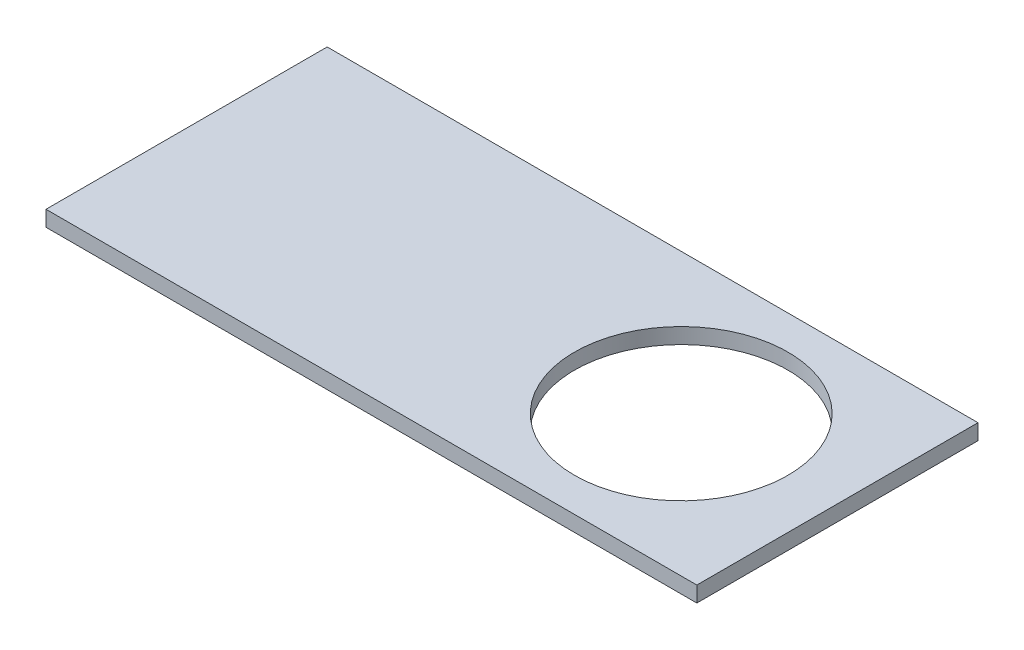
from build123d import *

# Parameters (mm, degrees)
SKETCH_1_W      = 250
SKETCH_1_H      = 108
SKETCH_1_R      = 41
EXTRUDE_1_DEPTH = 6


with BuildPart() as part:
    # Эскиз1 → Бобышка-Вытянуть1 (new body)
    with BuildSketch(Plane(origin=(0, 0, 0), x_dir=(1, 0, 0), z_dir=(0, 1, 0))):
        Rectangle(SKETCH_1_W, SKETCH_1_H)
        with Locations(Location((65, 0, 0), (0, 0, 270))):
            Circle(SKETCH_1_R, mode=Mode.SUBTRACT)
    extrude(amount=EXTRUDE_1_DEPTH)


solid = part.part
